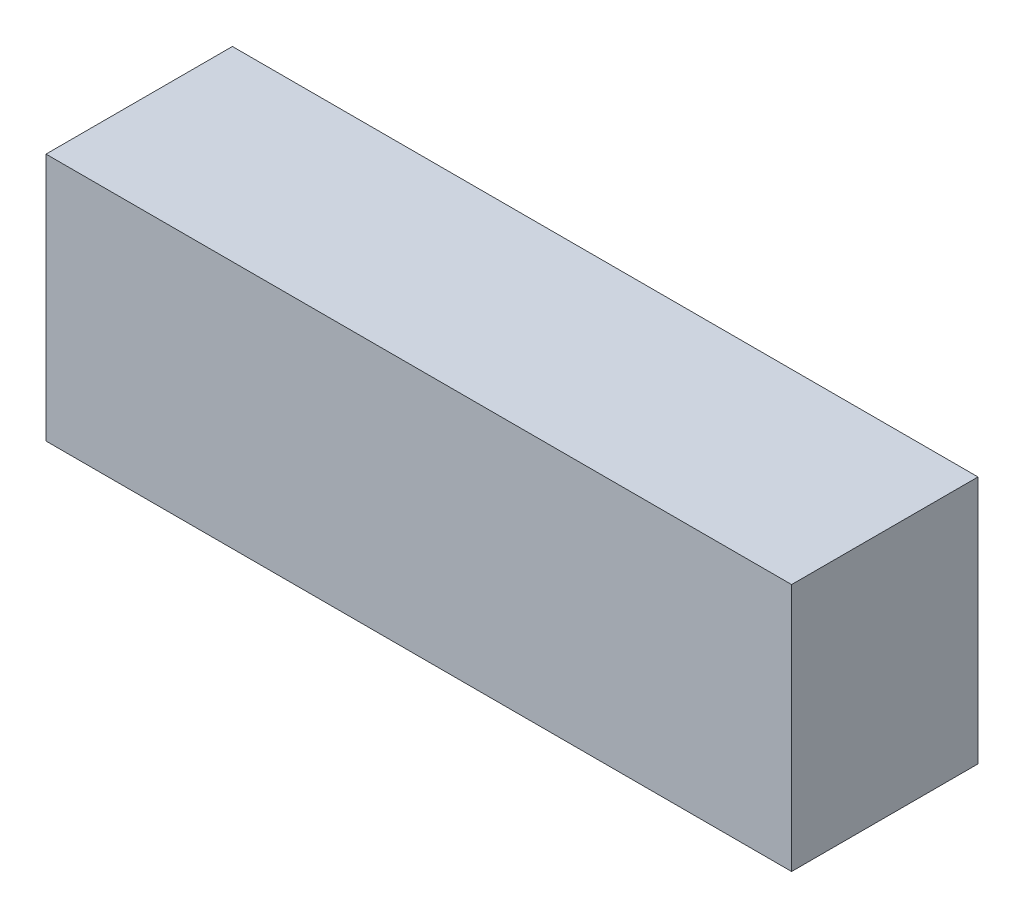
from build123d import *

# Parameters (mm, degrees)
SKETCH1_W           = 38.1
SKETCH1_H           = 12.7
BOSS_EXTRUDE1_DEPTH = 9.525


with BuildPart() as part:
    # Sketch1 → Boss-Extrude1 (new body)
    with BuildSketch(Plane.XY):
        Rectangle(SKETCH1_W, SKETCH1_H)
    extrude(amount=BOSS_EXTRUDE1_DEPTH)


solid = part.part
